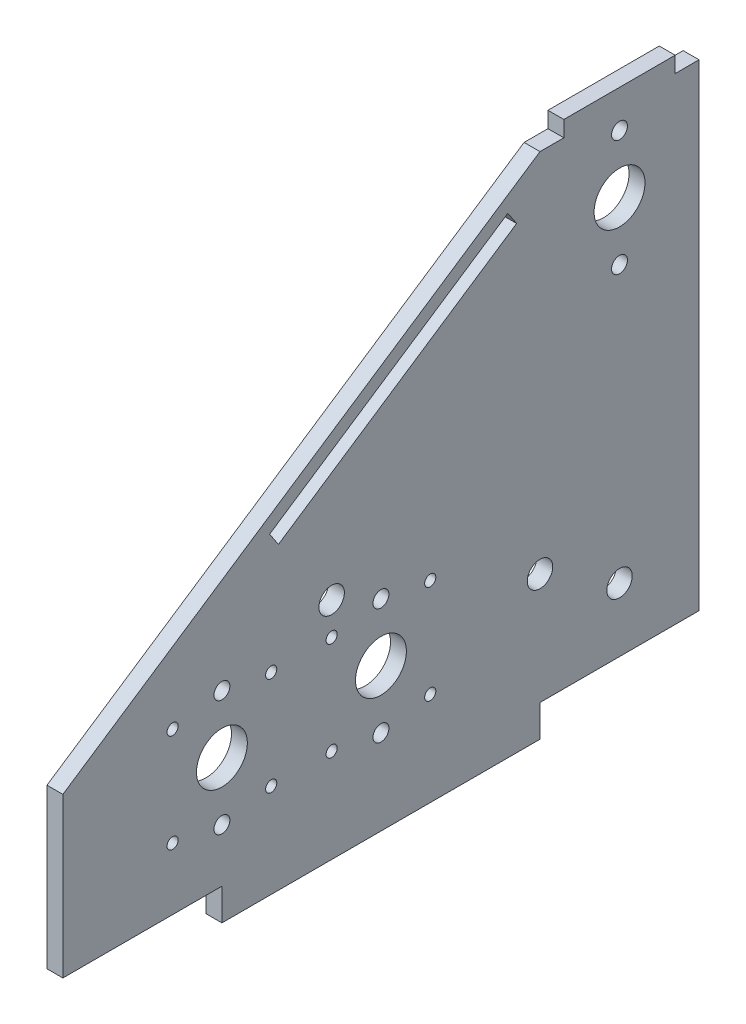
from build123d import *

# Parameters (mm, degrees)
CROQUIS1_R              = 8
CROQUIS1_R_2            = 4
CROQUIS1_R_3            = 2.5
CROQUIS1_R_4            = 1.75
SALIENTE_EXTRUIR1_DEPTH = 5


with BuildPart() as part:
    # Croquis1 → Saliente-Extruir1 (new body)
    with BuildSketch(Plane(origin=(0, 0, 0), x_dir=(0, 0, -1), z_dir=(1, 0, 0))):
        Polygon((150, 150), (0, 50), (0, 0), (50, 0), (50, -10), (150, -10), (150, 0), (200, 0), (200, 150), (192.5, 150), (192.5, 155), (157.5, 155), (157.5, 150), align=None)
        with Locations((175, 125)):
            Circle(CROQUIS1_R, mode=Mode.SUBTRACT)
        with Locations((175, 20)):
            Circle(CROQUIS1_R_2, mode=Mode.SUBTRACT)
        with Locations((150, 35)):
            Circle(CROQUIS1_R_2, mode=Mode.SUBTRACT)
        with Locations((175, 143.25)):
            Circle(CROQUIS1_R_3, mode=Mode.SUBTRACT)
        with Locations((175, 106.75)):
            Circle(CROQUIS1_R_3, mode=Mode.SUBTRACT)
        with Locations((100, 35)):
            Circle(CROQUIS1_R, mode=Mode.SUBTRACT)
        with Locations((84.5, 60.685599078)):
            Circle(CROQUIS1_R_2, mode=Mode.SUBTRACT)
        with Locations((100, 53.25)):
            Circle(CROQUIS1_R_3, mode=Mode.SUBTRACT)
        with Locations((100, 16.75)):
            Circle(CROQUIS1_R_3, mode=Mode.SUBTRACT)
        with Locations((84.5, 50.5)):
            Circle(CROQUIS1_R_4, mode=Mode.SUBTRACT)
        with Locations((115.5, 50.5)):
            Circle(CROQUIS1_R_4, mode=Mode.SUBTRACT)
        with Locations((115.5, 19.5)):
            Circle(CROQUIS1_R_4, mode=Mode.SUBTRACT)
        with Locations((84.5, 19.5)):
            Circle(CROQUIS1_R_4, mode=Mode.SUBTRACT)
        with Locations((50, 35)):
            Circle(CROQUIS1_R, mode=Mode.SUBTRACT)
        with Locations((50, 53.25)):
            Circle(CROQUIS1_R_3, mode=Mode.SUBTRACT)
        with Locations((50, 16.75)):
            Circle(CROQUIS1_R_3, mode=Mode.SUBTRACT)
        with Locations((34.5, 50.5)):
            Circle(CROQUIS1_R_4, mode=Mode.SUBTRACT)
        with Locations((65.5, 50.5)):
            Circle(CROQUIS1_R_4, mode=Mode.SUBTRACT)
        with Locations((65.5, 19.5)):
            Circle(CROQUIS1_R_4, mode=Mode.SUBTRACT)
        with Locations((34.5, 19.5)):
            Circle(CROQUIS1_R_4, mode=Mode.SUBTRACT)
        Polygon((65, 88.333333333), (139.88452649, 138.256350994), (142.658027472, 134.096099522), (67.773500981, 84.173081862), align=None, mode=Mode.SUBTRACT)
    extrude(amount=SALIENTE_EXTRUIR1_DEPTH)


solid = part.part
